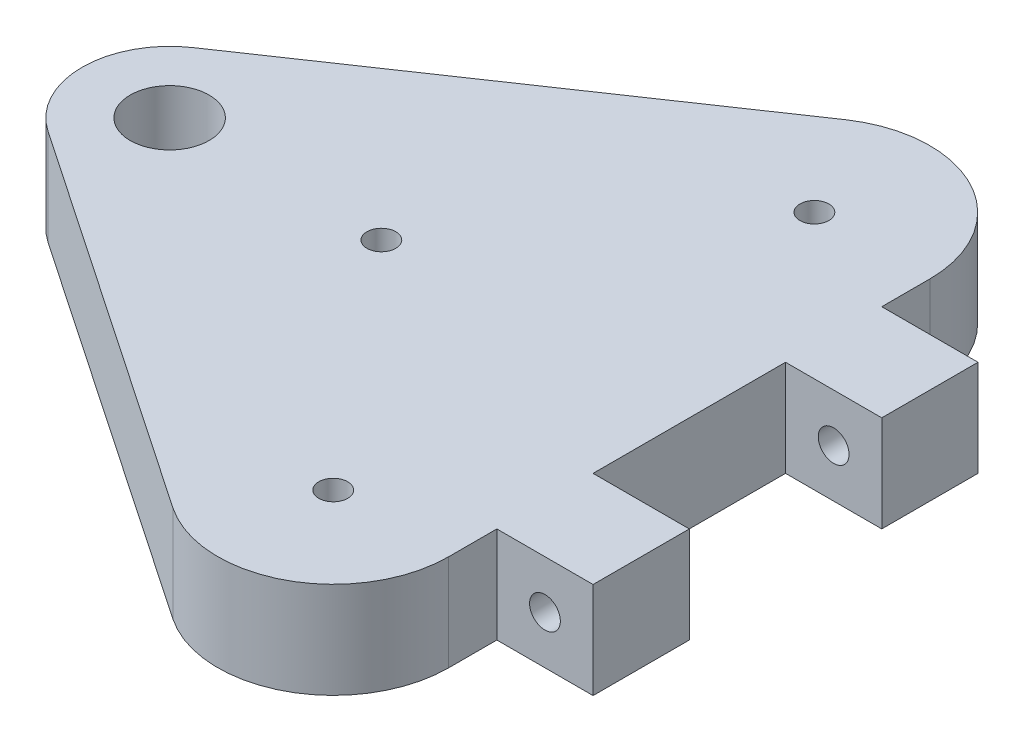
from build123d import *

# Parameters (mm, degrees)
SKETCH_1_R               = 4.1
EXTRUDE_1_DEPTH          = 10
SKETCH_2_W               = 10.2
SKETCH_2_H               = 10.2
CUT_EXTRUDE_1_DEPTH      = 5
SKETCH_3_W               = 10
SKETCH_3_H               = 10
EXTRUDE_2_DEPTH          = 10
CUT_EXTRUDE_2_DEPTH      = 64.876521508
CUT_EXTRUDE_2_DEPTH_BACK = 64.876521508
SKETCH_4_R               = 1.6
SKETCH_5_R               = 1.5
CUT_EXTRUDE_3_DEPTH      = 64.876521508


with BuildPart() as part:
    # ｽｹｯﾁ1 → ﾎﾞｽ - 押し出し1 (new body)
    with BuildSketch(Plane(origin=(0, 0, 0), x_dir=(1, 0, 0), z_dir=(0, 1, 0))):
        with BuildLine():
            Line((-47.110254718, 7.529627927), (-6.738797431, 34.929179684))
            ThreePointArc((-6.738797431, 34.929179684), (5.618470914, 35.603432679), (12, 25))
            Line((12, 25), (12, -25))
            ThreePointArc((12, -25), (5.618470914, -35.603432679), (-6.738797431, -34.929179684))
            Line((-6.738797431, -34.929179684), (-47.110254718, -7.529627927))
            ThreePointArc((-47.110254718, -7.529627927), (-51.1, 0), (-47.110254718, 7.529627927))
        make_face()
        with Locations(Location((-42, 0, 0), (0, 0, 270))):
            Circle(SKETCH_1_R, mode=Mode.SUBTRACT)
    extrude(amount=EXTRUDE_1_DEPTH)

    # ｽｹｯﾁ2 → ｶｯﾄ - 押し出し1 (cut)
    with BuildSketch(Plane.XZ):
        with Locations((0, 25)):
            Rectangle(SKETCH_2_W, SKETCH_2_H)
        with Locations((0, -25)):
            Rectangle(SKETCH_2_W, SKETCH_2_H)
        with Locations((-20, 0)):
            Rectangle(SKETCH_2_W, SKETCH_2_H)
    extrude(amount=-CUT_EXTRUDE_1_DEPTH, mode=Mode.SUBTRACT)

    # ｽｹｯﾁ3 → ﾎﾞｽ - 押し出し2 (add)
    with BuildSketch(Plane(origin=(12, 0, 0), x_dir=(0, 0, -1), z_dir=(1, 0, 0))):
        with Locations((-15, 5)):
            Rectangle(SKETCH_3_W, SKETCH_3_H)
        with Locations((15, 5)):
            Rectangle(SKETCH_3_W, SKETCH_3_H)
    extrude(amount=EXTRUDE_2_DEPTH)

    # ｽｹｯﾁ4 → ｶｯﾄ - 押し出し2 (cut, two sides: drawn at the far end of the back side and taken through both)
    with BuildSketch(Plane.XY.offset(-CUT_EXTRUDE_2_DEPTH_BACK)):
        with Locations((17, 5)):
            Circle(SKETCH_4_R)
    extrude(amount=CUT_EXTRUDE_2_DEPTH + CUT_EXTRUDE_2_DEPTH_BACK, mode=Mode.SUBTRACT)

    # ｽｹｯﾁ5 → ｶｯﾄ - 押し出し3 (cut, through all)
    with BuildSketch(Plane(origin=(0, 0, 0), x_dir=(1, 0, 0), z_dir=(0, 1, 0))):
        with Locations(Location((0, -25, 0), (0, 0, 270))):
            Circle(SKETCH_5_R)
        with Locations(Location((-20, 0, 0), (0, 0, 270))):
            Circle(SKETCH_5_R)
        with Locations(Location((0, 25, 0), (0, 0, 90))):
            Circle(SKETCH_5_R)
    extrude(amount=CUT_EXTRUDE_3_DEPTH, mode=Mode.SUBTRACT)


solid = part.part
